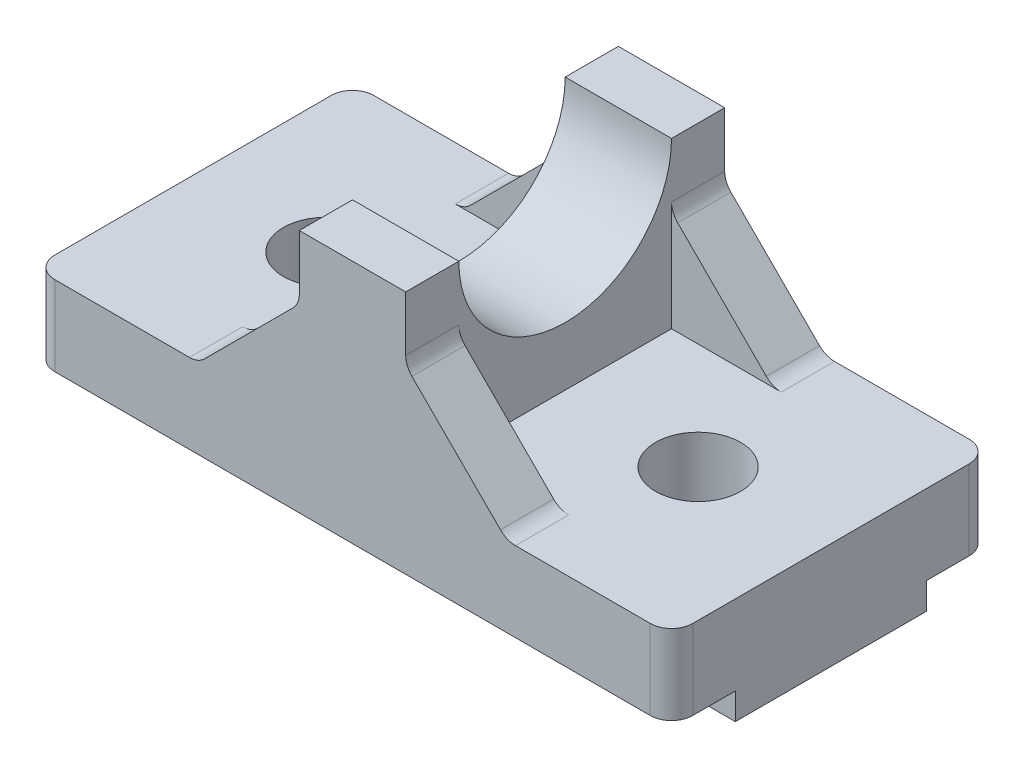
from build123d import *

# Parameters (mm, degrees)
BOSS_EXTRUDE1_DEPTH     = 30
SKETCH2_W               = 36
SKETCH2_H               = 5
BOSS_EXTRUDE2_DEPTH     = 60
FILLET1_R               = 4
SKETCH4_W               = 20.656854249
SKETCH4_H               = 40
CUT_EXTRUDE1_DEPTH      = 31
CUT_EXTRUDE2_REACH      = 75.899
SKETCH3_R               = 8
CUT_EXTRUDE3_DEPTH      = 89.971905678
CUT_EXTRUDE3_DEPTH_BACK = 89.971905678


with BuildPart() as part:
    # Sketch1 → Boss-Extrude1 (new, symmetric)
    with BuildSketch(Plane.XY):
        with BuildLine():
            Line((10, 46), (-10, 46))
            Line((-10, 46), (-10, 35.656854249))
            ThreePointArc((-10, 35.656854249), (-10.30448187, 34.12612052), (-11.171572875, 32.828427125))
            Line((-11.171572875, 32.828427125), (-27.828427125, 16.171572875))
            ThreePointArc((-27.828427125, 16.171572875), (-29.12612052, 15.30448187), (-30.656854249, 15))
            Line((-30.656854249, 15), (-60, 15))
            Line((-60, 15), (-60, 0))
            Line((-60, 0), (60, 0))
            Line((60, 0), (60, 15))
            Line((60, 15), (30.656854249, 15))
            ThreePointArc((30.656854249, 15), (29.12612052, 15.30448187), (27.828427125, 16.171572875))
            Line((27.828427125, 16.171572875), (11.171572875, 32.828427125))
            ThreePointArc((11.171572875, 32.828427125), (10.30448187, 34.12612052), (10, 35.656854249))
            Line((10, 35.656854249), (10, 46))
        make_face()
    extrude(amount=BOSS_EXTRUDE1_DEPTH, both=True)

    # Sketch2 → Boss-Extrude2 (add, symmetric)
    with BuildSketch(Plane(origin=(0, 0, 0), x_dir=(0, 0, -1), z_dir=(1, 0, 0))):
        with Locations((0, -2.5)):
            Rectangle(SKETCH2_W, SKETCH2_H)
    extrude(amount=BOSS_EXTRUDE2_DEPTH, both=True)

    # Fillet1
    fillet1_edges = [part.edges().sort_by_distance(p)[0] for p in [
        (-60, 7.5, 30),
        (60, 7.5, -30),
        (-60, 7.5, -30),
        (60, 7.5, 30),
    ]]
    fillet(fillet1_edges, radius=FILLET1_R)

    # Sketch4 → Cut-Extrude1 (cut)
    with BuildSketch(Plane(origin=(0, 46, 0), x_dir=(1, 0, 0), z_dir=(0, 1, 0))):
        with Locations((-20.328427125, 0)):
            Rectangle(SKETCH4_W, SKETCH4_H)
    cut_extrude1 = extrude(amount=-CUT_EXTRUDE1_DEPTH, mode=Mode.SUBTRACT)

    # Sketch3 → Cut-Extrude2 (cut, up to next)
    with BuildSketch(Plane(origin=(0, 15, 0), x_dir=(1, 0, 0), z_dir=(0, 1, 0)), mode=Mode.PRIVATE) as cut_extrude2_sk1:
        with Locations(Location((-35, 0, 0), (0, 0, 180))):
            Circle(SKETCH3_R)
    cut_extrude2_tool1 = extrude(cut_extrude2_sk1.sketch, amount=-CUT_EXTRUDE2_REACH, mode=Mode.PRIVATE) & part.part
    cut_extrude2 = cut_extrude2_tool1.solids().sort_by_distance((-35, 15, 0))[0]
    add(cut_extrude2, mode=Mode.SUBTRACT)

    # Mirror1: Cut-Extrude1, Cut-Extrude2 across plane
    add(cut_extrude1.mirror(Plane(origin=(0, 0, 0), x_dir=(0, 0, 1), z_dir=(1, 0, 0))), mode=Mode.SUBTRACT)
    add(cut_extrude2.mirror(Plane(origin=(0, 0, 0), x_dir=(0, 0, 1), z_dir=(1, 0, 0))), mode=Mode.SUBTRACT)

    # Sketch5 → Cut-Extrude3 (cut, two sides: drawn at the far end of the back side and taken through both)
    with BuildSketch(Plane.ZY.offset(10).offset(-CUT_EXTRUDE3_DEPTH_BACK)):
        with BuildLine():
            Line((-20, 198.842570685), (-20, 46))
            ThreePointArc((-20, 46), (0, 26), (20, 46))
            Line((20, 46), (20, 198.842570685))
            Line((20, 198.842570685), (20, 504.527712056))
            Line((20, 504.527712056), (-20, 504.527712056))
            Line((-20, 504.527712056), (-20, 198.842570685))
        make_face()
    extrude(amount=CUT_EXTRUDE3_DEPTH + CUT_EXTRUDE3_DEPTH_BACK, mode=Mode.SUBTRACT)


solid = part.part
